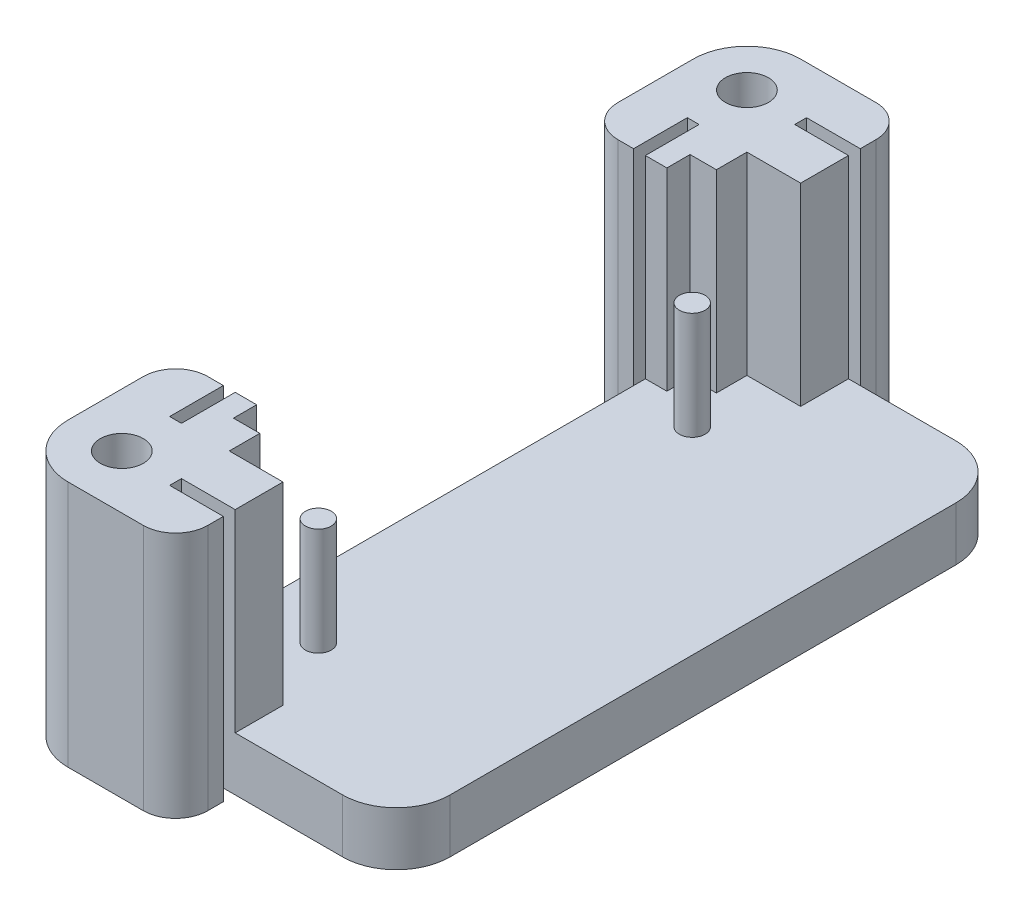
from build123d import *

# Parameters (mm, degrees)
SKETCH1_W                  = 93.58
SKETCH1_H                  = 68.18
BASE_DEPTH                 = 5
SKETCH1_3_W                = 4.45
SKETCH1_3_H                = 4.45
SKETCH1_3_W_2              = 1.1
SKETCH1_3_H_2              = 1.1
SKETCH1_3_H_3              = 5
SKETCH1_3_W_3              = 5
WALLS_DEPTH                = 23
SKETCH1_4_W                = 63.58
SKETCH1_4_H                = 1.1
SKETCH1_4_W_2              = 5
SKETCH1_4_W_3              = 1.1
SKETCH1_4_H_2              = 5
SKETCH1_4_H_3              = 38.18
ACRYLIC_CUT_DEPTH          = 23
SKETCH2_W                  = 4.45
SKETCH2_H                  = 38.18
SKETCH2_W_2                = 63.58
SKETCH2_H_2                = 4.45
CUT_EXTRUDE2_DEPTH         = 63.293115189
SKETCH3_W                  = 58
SKETCH3_H                  = 42.5
BOARD_CUTOUT_DEPTH         = 18
SKETCH3_2_R                = 1.2
SCREW_HOLES_DEPTH          = 10
FILLET1_R                  = 5
FILLET3_R                  = 3
SKETCH6_R                  = 2
CUT_EXTRUDE3_DEPTH         = 63.293115189
BOTTOM_HALF_CUT_DEPTH      = 61.625342886
BOTTOM_HALF_CUT_DEPTH_BACK = 61.625342886
SKETCH5_W                  = 63.58
SKETCH5_H                  = 68.18
FILLET4_R                  = 5


with BuildPart() as part:
    # Sketch1 → Base (new body)
    with BuildSketch(Plane(origin=(0, 0, 0), x_dir=(1, 0, 0), z_dir=(0, 1, 0))):
        Rectangle(SKETCH1_W, SKETCH1_H)
    extrude(amount=BASE_DEPTH)

    # Sketch1<3> → Walls (add)
    with BuildSketch(Plane(origin=(0, 0, 0), x_dir=(1, 0, 0), z_dir=(0, 1, 0))):
        with Locations((-44.565, 31.865)):
            Rectangle(SKETCH1_3_W, SKETCH1_3_H)
        with Locations((-39.015, 31.865)):
            Rectangle(SKETCH1_3_W, SKETCH1_3_H)
        with Locations((-39.015, 26.315)):
            Rectangle(SKETCH1_3_W, SKETCH1_3_H)
        with Locations((-44.565, 26.315)):
            Rectangle(SKETCH1_3_W, SKETCH1_3_H)
        with Locations((-41.79, 31.865)):
            Rectangle(SKETCH1_3_W_2, SKETCH1_3_H)
        with Locations((-39.015, 29.09)):
            Rectangle(SKETCH1_3_W, SKETCH1_3_H_2)
        with Locations((-44.565, 29.09)):
            Rectangle(SKETCH1_3_W, SKETCH1_3_H_2)
        with Locations((-41.79, 26.315)):
            Rectangle(SKETCH1_3_W_2, SKETCH1_3_H)
        with Locations((-41.79, 29.09)):
            Rectangle(SKETCH1_3_W_2, SKETCH1_3_H_2)
        with Locations((-39.015, 21.59)):
            Rectangle(SKETCH1_3_W, SKETCH1_3_H_3)
        with Locations((-44.565, 21.59)):
            Rectangle(SKETCH1_3_W, SKETCH1_3_H_3)
        with Locations((-34.29, 26.315)):
            Rectangle(SKETCH1_3_W_3, SKETCH1_3_H)
        with Locations((-34.29, 31.865)):
            Rectangle(SKETCH1_3_W_3, SKETCH1_3_H)
        with Locations((-44.565, -21.59)):
            Rectangle(SKETCH1_3_W, SKETCH1_3_H_3)
        with Locations((-39.015, -21.59)):
            Rectangle(SKETCH1_3_W, SKETCH1_3_H_3)
        with Locations((-39.015, -26.315)):
            Rectangle(SKETCH1_3_W, SKETCH1_3_H)
        with Locations((-44.565, -26.315)):
            Rectangle(SKETCH1_3_W, SKETCH1_3_H)
        with Locations((-44.565, -31.865)):
            Rectangle(SKETCH1_3_W, SKETCH1_3_H)
        with Locations((-39.015, -31.865)):
            Rectangle(SKETCH1_3_W, SKETCH1_3_H)
        with Locations((-34.29, -31.865)):
            Rectangle(SKETCH1_3_W_3, SKETCH1_3_H)
        with Locations((-34.29, -26.315)):
            Rectangle(SKETCH1_3_W_3, SKETCH1_3_H)
        with Locations((-39.015, -29.09)):
            Rectangle(SKETCH1_3_W, SKETCH1_3_H_2)
        with Locations((-44.565, -29.09)):
            Rectangle(SKETCH1_3_W, SKETCH1_3_H_2)
        with Locations((-41.79, -31.865)):
            Rectangle(SKETCH1_3_W_2, SKETCH1_3_H)
        with Locations((-41.79, -29.09)):
            Rectangle(SKETCH1_3_W_2, SKETCH1_3_H_2)
        with Locations((-41.79, -26.315)):
            Rectangle(SKETCH1_3_W_2, SKETCH1_3_H)
        with Locations((34.29, -31.865)):
            Rectangle(SKETCH1_3_W_3, SKETCH1_3_H)
        with Locations((34.29, -26.315)):
            Rectangle(SKETCH1_3_W_3, SKETCH1_3_H)
        with Locations((39.015, -26.315)):
            Rectangle(SKETCH1_3_W, SKETCH1_3_H)
        with Locations((39.015, -31.865)):
            Rectangle(SKETCH1_3_W, SKETCH1_3_H)
        with Locations((44.565, -31.865)):
            Rectangle(SKETCH1_3_W, SKETCH1_3_H)
        with Locations((44.565, -26.315)):
            Rectangle(SKETCH1_3_W, SKETCH1_3_H)
        with Locations((39.015, -21.59)):
            Rectangle(SKETCH1_3_W, SKETCH1_3_H_3)
        with Locations((44.565, -21.59)):
            Rectangle(SKETCH1_3_W, SKETCH1_3_H_3)
        with Locations((41.79, -26.315)):
            Rectangle(SKETCH1_3_W_2, SKETCH1_3_H)
        with Locations((41.79, -29.09)):
            Rectangle(SKETCH1_3_W_2, SKETCH1_3_H_2)
        with Locations((41.79, -31.865)):
            Rectangle(SKETCH1_3_W_2, SKETCH1_3_H)
        with Locations((39.015, -29.09)):
            Rectangle(SKETCH1_3_W, SKETCH1_3_H_2)
        with Locations((44.565, -29.09)):
            Rectangle(SKETCH1_3_W, SKETCH1_3_H_2)
        with Locations((44.565, 21.59)):
            Rectangle(SKETCH1_3_W, SKETCH1_3_H_3)
        with Locations((34.29, 26.315)):
            Rectangle(SKETCH1_3_W_3, SKETCH1_3_H)
        with Locations((39.015, 21.59)):
            Rectangle(SKETCH1_3_W, SKETCH1_3_H_3)
        with Locations((34.29, 31.865)):
            Rectangle(SKETCH1_3_W_3, SKETCH1_3_H)
        with Locations((39.015, 26.315)):
            Rectangle(SKETCH1_3_W, SKETCH1_3_H)
        with Locations((39.015, 31.865)):
            Rectangle(SKETCH1_3_W, SKETCH1_3_H)
        with Locations((44.565, 31.865)):
            Rectangle(SKETCH1_3_W, SKETCH1_3_H)
        with Locations((44.565, 26.315)):
            Rectangle(SKETCH1_3_W, SKETCH1_3_H)
        with Locations((41.79, 26.315)):
            Rectangle(SKETCH1_3_W_2, SKETCH1_3_H)
        with Locations((41.79, 31.865)):
            Rectangle(SKETCH1_3_W_2, SKETCH1_3_H)
        with Locations((39.015, 29.09)):
            Rectangle(SKETCH1_3_W, SKETCH1_3_H_2)
        with Locations((41.79, 29.09)):
            Rectangle(SKETCH1_3_W_2, SKETCH1_3_H_2)
        with Locations((44.565, 29.09)):
            Rectangle(SKETCH1_3_W, SKETCH1_3_H_2)
        with Locations((-41.79, 21.59)):
            Rectangle(SKETCH1_3_W_2, SKETCH1_3_H_3)
        with Locations((-34.29, 29.09)):
            Rectangle(SKETCH1_3_W_3, SKETCH1_3_H_2)
        with Locations((-41.79, -21.59)):
            Rectangle(SKETCH1_3_W_2, SKETCH1_3_H_3)
        with Locations((-34.29, -29.09)):
            Rectangle(SKETCH1_3_W_3, SKETCH1_3_H_2)
        with Locations((34.29, -29.09)):
            Rectangle(SKETCH1_3_W_3, SKETCH1_3_H_2)
        with Locations((41.79, -21.59)):
            Rectangle(SKETCH1_3_W_2, SKETCH1_3_H_3)
        with Locations((41.79, 21.59)):
            Rectangle(SKETCH1_3_W_2, SKETCH1_3_H_3)
        with Locations((34.29, 29.09)):
            Rectangle(SKETCH1_3_W_3, SKETCH1_3_H_2)
    extrude(amount=WALLS_DEPTH)

    # Sketch1<4> → Acrylic Cut (cut)
    with BuildSketch(Plane(origin=(0, 0, 0), x_dir=(1, 0, 0), z_dir=(0, 1, 0))):
        with Locations((0, -29.09)):
            Rectangle(SKETCH1_4_W, SKETCH1_4_H)
        with Locations((-34.29, -29.09)):
            Rectangle(SKETCH1_4_W_2, SKETCH1_4_H)
        with Locations((34.29, -29.09)):
            Rectangle(SKETCH1_4_W_2, SKETCH1_4_H)
        with Locations((-41.79, -21.59)):
            Rectangle(SKETCH1_4_W_3, SKETCH1_4_H_2)
        with Locations((-41.79, 0)):
            Rectangle(SKETCH1_4_W_3, SKETCH1_4_H_3)
        with Locations((-41.79, 21.59)):
            Rectangle(SKETCH1_4_W_3, SKETCH1_4_H_2)
        with Locations((0, 29.09)):
            Rectangle(SKETCH1_4_W, SKETCH1_4_H)
        with Locations((-34.29, 29.09)):
            Rectangle(SKETCH1_4_W_2, SKETCH1_4_H)
        with Locations((34.29, 29.09)):
            Rectangle(SKETCH1_4_W_2, SKETCH1_4_H)
        with Locations((41.79, 21.59)):
            Rectangle(SKETCH1_4_W_3, SKETCH1_4_H_2)
        with Locations((41.79, 0)):
            Rectangle(SKETCH1_4_W_3, SKETCH1_4_H_3)
        with Locations((41.79, -21.59)):
            Rectangle(SKETCH1_4_W_3, SKETCH1_4_H_2)
    extrude(amount=ACRYLIC_CUT_DEPTH, mode=Mode.SUBTRACT)

    # Sketch2 → Cut-Extrude2 (cut, through all)
    with BuildSketch(Plane(origin=(0, 23, 0), x_dir=(1, 0, 0), z_dir=(0, 1, 0))):
        with Locations((-44.565, 0)):
            Rectangle(SKETCH2_W, SKETCH2_H)
        with Locations((0, 31.865)):
            Rectangle(SKETCH2_W_2, SKETCH2_H_2)
        with Locations((44.565, 0)):
            Rectangle(SKETCH2_W, SKETCH2_H)
        with Locations((0, -31.865)):
            Rectangle(SKETCH2_W_2, SKETCH2_H_2)
    extrude(amount=-CUT_EXTRUDE2_DEPTH, mode=Mode.SUBTRACT)

    # Sketch3 → Board Cutout (cut)
    with BuildSketch(Plane(origin=(0, 5, 0), x_dir=(1, 0, 0), z_dir=(0, 1, 0))):
        with Locations((-10.24, 0)):
            Rectangle(SKETCH3_W, SKETCH3_H)
    extrude(amount=BOARD_CUTOUT_DEPTH, mode=Mode.SUBTRACT)

    # Sketch3<2> → Screw Holes (add)
    with BuildSketch(Plane(origin=(0, 5, 0), x_dir=(1, 0, 0), z_dir=(0, 1, 0))):
        with Locations(Location((-35.19, -17.4, 0), (0, 0, 90))):
            Circle(SKETCH3_2_R)
        with Locations(Location((14.71, -17.4, 0), (0, 0, 90))):
            Circle(SKETCH3_2_R)
        with Locations(Location((14.71, 17.4, 0), (0, 0, 90))):
            Circle(SKETCH3_2_R)
        with Locations(Location((-35.19, 17.4, 0), (0, 0, 90))):
            Circle(SKETCH3_2_R)
    extrude(amount=SCREW_HOLES_DEPTH)

    # Fillet1
    fillet1_edges = [part.edges().sort_by_distance(p)[0] for p in [
        (-46.79, 11.5, 34.09),
        (46.79, 11.5, 34.09),
        (46.79, 11.5, -34.09),
        (-46.79, 11.5, -34.09),
    ]]
    fillet(fillet1_edges, radius=FILLET1_R)

    # Fillet3
    fillet3_edges = [part.edges().sort_by_distance(p)[0] for p in [
        (46.79, 11.5, -19.09),
        (31.79, 11.5, -34.09),
        (-31.79, 11.5, -34.09),
        (-46.79, 11.5, -19.09),
        (-31.79, 11.5, 34.09),
        (-46.79, 11.5, 19.09),
        (46.79, 11.5, 19.09),
        (31.79, 11.5, 34.09),
    ]]
    fillet(fillet3_edges, radius=FILLET3_R)

    # Sketch6 → Cut-Extrude3 (cut, through all)
    with BuildSketch(Plane(origin=(0, 23, 0), x_dir=(1, 0, 0), z_dir=(0, 1, 0))):
        with Locations(Location((-41.79, 29.09, 0), (0, 0, 270))):
            Circle(SKETCH6_R)
        with Locations(Location((41.79, 29.09, 0), (0, 0, 90))):
            Circle(SKETCH6_R)
        with Locations(Location((41.79, -29.09, 0), (0, 0, 270))):
            Circle(SKETCH6_R)
        with Locations(Location((-41.79, -29.09, 0), (0, 0, 90))):
            Circle(SKETCH6_R)
    extrude(amount=-CUT_EXTRUDE3_DEPTH, mode=Mode.SUBTRACT)

    # Sketch5 → Bottom Half Cut (cut, two sides: drawn at the far end of the back side and taken through both)
    with BuildSketch(Plane(origin=(0, 5, 0), x_dir=(1, 0, 0), z_dir=(0, 1, 0)).offset(-BOTTOM_HALF_CUT_DEPTH_BACK)):
        with Locations((15, 0)):
            Rectangle(SKETCH5_W, SKETCH5_H)
    extrude(amount=BOTTOM_HALF_CUT_DEPTH + BOTTOM_HALF_CUT_DEPTH_BACK, mode=Mode.SUBTRACT)

    # Fillet4
    fillet4_edges = [part.edges().sort_by_distance(p)[0] for p in [
        (-16.79, 2.5, 28.54),
        (-16.79, 2.5, -28.54),
    ]]
    fillet(fillet4_edges, radius=FILLET4_R)


solid = part.part
